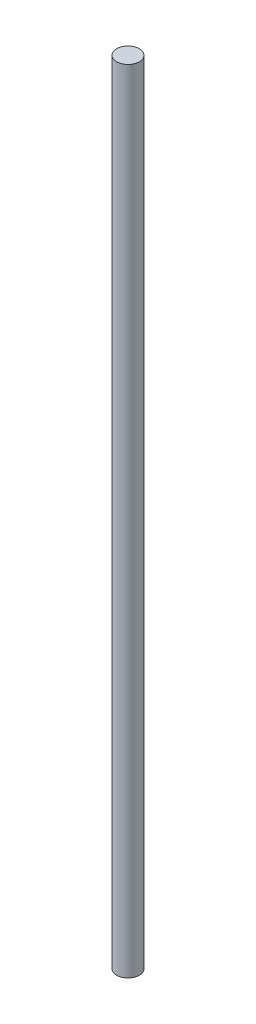
from build123d import *

# Parameters (mm, degrees)
SKETCH_1_R      = 10
EXTRUDE_1_DEPTH = 700


with BuildPart() as part:
    # 草图1 → 凸台-拉伸1 (new body)
    with BuildSketch(Plane(origin=(0, 0, 0), x_dir=(1, 0, 0), z_dir=(0, 1, 0))):
        with Locations(Location((0, 0, 0), (0, 0, 270))):
            Circle(SKETCH_1_R)
    extrude(amount=EXTRUDE_1_DEPTH)


solid = part.part
